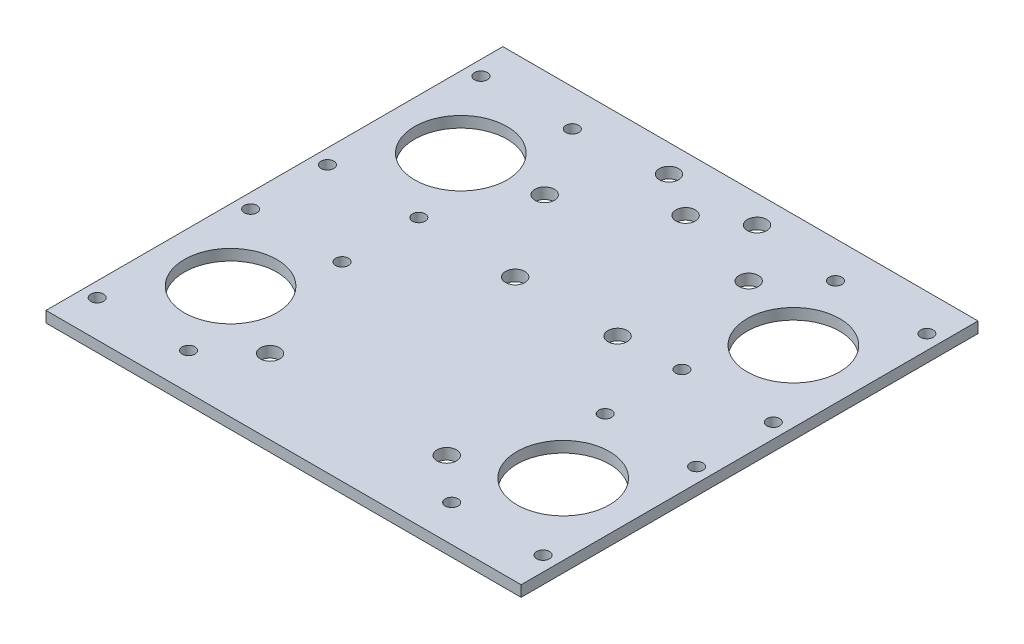
from build123d import *

# Parameters (mm, degrees)
SKETCH1_W                 = 130
SKETCH1_H                 = 125
BOSS_EXTRUDE1_DEPTH       = 3
SKETCH2_R                 = 1.75
SKETCH2_R_2               = 12.65
CUT_EXTRUDE1_DEPTH        = 10
MIRROR4_COPY_1_SKETCH_R   = 1.75
MIRROR4_COPY_1_SKETCH_R_2 = 12.65
MIRROR4_COPY_1_DEPTH      = 10
SKETCH3_R                 = 2.65
CUT_EXTRUDE2_DEPTH        = 10
SKETCH4_R                 = 2.65
CUT_EXTRUDE3_DEPTH        = 10


with BuildPart() as part:
    # Sketch1 → Boss-Extrude1 (new body)
    with BuildSketch(Plane(origin=(0, 0, 0), x_dir=(1, 0, 0), z_dir=(0, 1, 0))):
        Rectangle(SKETCH1_W, SKETCH1_H)
    extrude(amount=BOSS_EXTRUDE1_DEPTH)

    # Sketch2 → Cut-Extrude1 (cut)
    with BuildSketch(Plane(origin=(0, 3, 0), x_dir=(1, 0, 0), z_dir=(0, 1, 0))):
        with Locations(Location((-61, -52.5, 0), (0, 0, 270))):
            Circle(SKETCH2_R)
        with Locations(Location((-36, -52.5, 0), (0, 0, 270))):
            Circle(SKETCH2_R)
        with Locations(Location((-36, -10.5, 0), (0, 0, 270))):
            Circle(SKETCH2_R)
        with Locations(Location((-61, -10.5, 0), (0, 0, 270))):
            Circle(SKETCH2_R)
        with Locations(Location((-45.5, -31.5, 0), (0, 0, 270))):
            Circle(SKETCH2_R_2)
    cut_extrude1 = extrude(amount=-CUT_EXTRUDE1_DEPTH, mode=Mode.SUBTRACT)

    # Mirror3: Cut-Extrude1 across plane
    add(cut_extrude1.mirror(Plane.ZY), mode=Mode.SUBTRACT)

    # Mirror4: Cut-Extrude1 across plane
    add(cut_extrude1.mirror(Plane.XY), mode=Mode.SUBTRACT)

    # Mirror4 copy 1 sketch → Mirror4 copy 1 (cut)
    with BuildSketch(Plane(origin=(0, 3, 0), x_dir=(-1, 0, 0), z_dir=(0, 1, 0))):
        with Locations(Location((-61, -52.5, 0), (0, 0, 270))):
            Circle(MIRROR4_COPY_1_SKETCH_R)
        with Locations(Location((-36, -52.5, 0), (0, 0, 270))):
            Circle(MIRROR4_COPY_1_SKETCH_R)
        with Locations(Location((-36, -10.5, 0), (0, 0, 270))):
            Circle(MIRROR4_COPY_1_SKETCH_R)
        with Locations(Location((-61, -10.5, 0), (0, 0, 270))):
            Circle(MIRROR4_COPY_1_SKETCH_R)
        with Locations(Location((-45.5, -31.5, 0), (0, 0, 270))):
            Circle(MIRROR4_COPY_1_SKETCH_R_2)
    extrude(amount=-MIRROR4_COPY_1_DEPTH, mode=Mode.SUBTRACT)

    # Sketch3 → Cut-Extrude2 (cut)
    with BuildSketch(Plane(origin=(0, 3, 0), x_dir=(1, 0, 0), z_dir=(0, 1, 0))):
        with Locations(Location((-24.17, -42.03, 0), (0, 0, 270))):
            Circle(SKETCH3_R)
        with Locations(Location((24.17, -42.03, 0), (0, 0, 270))):
            Circle(SKETCH3_R)
        with Locations(Location((-8.73, 9.6, 0), (0, 0, 270))):
            Circle(SKETCH3_R)
        with Locations(Location((19.29, 9.6, 0), (0, 0, 270))):
            Circle(SKETCH3_R)
        with Locations(Location((-24.17, 33.11, 0), (0, 0, 270))):
            Circle(SKETCH3_R)
        with Locations(Location((24.17, 40.6, 0), (0, 0, 270))):
            Circle(SKETCH3_R)
    extrude(amount=-CUT_EXTRUDE2_DEPTH, mode=Mode.SUBTRACT)

    # Sketch4 → Cut-Extrude3 (cut)
    with BuildSketch(Plane(origin=(0, 3, 0), x_dir=(1, 0, 0), z_dir=(0, 1, 0))):
        with Locations(Location((0, 47.5, 0), (0, 0, 270))):
            Circle(SKETCH4_R)
        with Locations(Location((12.049810205, 55, 0), (0, 0, 270))):
            Circle(SKETCH4_R)
        with Locations(Location((-12.049810205, 55, 0), (0, 0, 270))):
            Circle(SKETCH4_R)
    extrude(amount=-CUT_EXTRUDE3_DEPTH, mode=Mode.SUBTRACT)


solid = part.part
